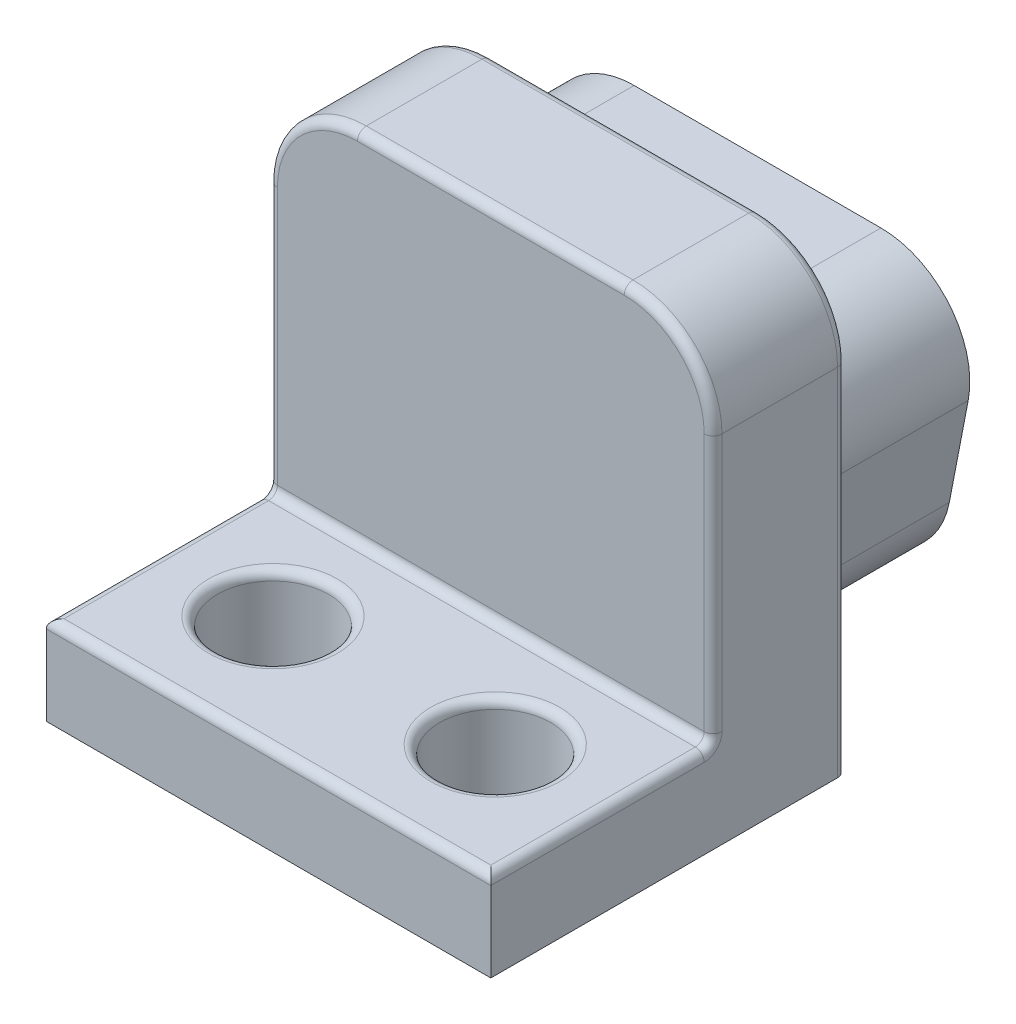
from build123d import *

# Parameters (mm, degrees)
SKETCH1_W           = 12.7
SKETCH1_H           = 10.16
BASE_EXTRUDE_DEPTH  = 12.7
BOSS_EXTRUDE1_DEPTH = 3.81
SKETCH4_R           = 0.635
CUT_EXTRUDE1_DEPTH  = 5.08
SKETCH5_R           = 0.635
CUT_EXTRUDE2_DEPTH  = 5.08
SKETCH6_R           = 0.3556
BOSS_EXTRUDE2_DEPTH = 0.254
LPATTERN1_COUNT     = 2
LPATTERN1_PITCH     = 2.7686
LPATTERN2_COUNT     = 4
LPATTERN2_PITCH     = 2.7686
LPATTERN3_COUNT     = 3
LPATTERN3_PITCH     = 2.7686
SKETCH7_R           = 0.3556
BOSS_EXTRUDE3_DEPTH = 0.254
LPATTERN4_COUNT     = 2
LPATTERN4_PITCH     = 2.7686
SKETCH9_W           = 6.35508
SKETCH9_H           = 10.16
CUT_EXTRUDE3_DEPTH  = 6.35
SKETCH11_R          = 1.5875
CUT_EXTRUDE4_DEPTH  = 19.680659624
FILLET1_R           = 2.54
FILLET2_R           = 0.254
FILETE1_R           = 0.254


with BuildPart() as part:
    # Sketch1 → Base-Extrude (new body)
    with BuildSketch(Plane(origin=(0, 0, 0), x_dir=(1, 0, 0), z_dir=(0, 1, 0))):
        with Locations((-3.81, 3.048)):
            Rectangle(SKETCH1_W, SKETCH1_H)
    extrude(amount=BASE_EXTRUDE_DEPTH)

    # Sketch2 → Boss-Extrude1 (add)
    with BuildSketch(Plane(origin=(0, 0, -8.128), x_dir=(-1, 0, 0), z_dir=(0, 0, -1))):
        with BuildLine():
            Line((0.825676487, 2.286), (6.794323513, 2.286))
            ThreePointArc((6.794323513, 2.286), (8.410817218, 2.8667787), (9.288078551, 4.34352118))
            Line((9.288078551, 4.34352118), (9.828647213, 7.13752118))
            ThreePointArc((9.828647213, 7.13752118), (9.294113475, 9.236493705), (7.334892175, 10.16))
            Line((7.334892175, 10.16), (0.285107825, 10.16))
            ThreePointArc((0.285107825, 10.16), (-1.674113475, 9.236493705), (-2.208647213, 7.13752118))
            Line((-2.208647213, 7.13752118), (-1.668078551, 4.34352118))
            ThreePointArc((-1.668078551, 4.34352118), (-0.790817218, 2.8667787), (0.825676487, 2.286))
        make_face()
    extrude(amount=BOSS_EXTRUDE1_DEPTH)

    # Sketch4 → Cut-Extrude1 (cut)
    with BuildSketch(Plane(origin=(0, 0, -11.938), x_dir=(-1, 0, 0), z_dir=(0, 0, -1))):
        with Locations((8.128, 7.62)):
            Circle(SKETCH4_R)
    cut_extrude1 = extrude(amount=-CUT_EXTRUDE1_DEPTH, mode=Mode.SUBTRACT)

    # Sketch5 → Cut-Extrude2 (cut)
    with BuildSketch(Plane(origin=(0, 0, -11.938), x_dir=(-1, 0, 0), z_dir=(0, 0, -1))):
        with Locations((6.858, 5.08)):
            Circle(SKETCH5_R)
    cut_extrude2 = extrude(amount=-CUT_EXTRUDE2_DEPTH, mode=Mode.SUBTRACT)

    # Sketch6 → Boss-Extrude2 (add)
    with BuildSketch(Plane.XZ):
        with Locations(Location((-5.08, 0, 0), (0, 0, 270))):
            Circle(SKETCH6_R)
    boss_extrude2 = extrude(amount=BOSS_EXTRUDE2_DEPTH)

    # LPattern1: Boss-Extrude2 ×2
    with Locations(*[(i * LPATTERN1_PITCH, 0, 0) for i in range(1, LPATTERN1_COUNT)]):
        add(boss_extrude2)

    # LPattern2: Cut-Extrude1 ×4
    with Locations(*[(i * LPATTERN2_PITCH, 0, 0) for i in range(1, LPATTERN2_COUNT)]):
        add(cut_extrude1, mode=Mode.SUBTRACT)

    # LPattern3: Cut-Extrude2 ×3
    with Locations(*[(i * LPATTERN3_PITCH, 0, 0) for i in range(1, LPATTERN3_COUNT)]):
        add(cut_extrude2, mode=Mode.SUBTRACT)

    # Sketch7 → Boss-Extrude3 (add)
    with BuildSketch(Plane.XZ):
        with Locations(Location((-5.08, -2.54, 0), (0, 0, 270))):
            Circle(SKETCH7_R)
    boss_extrude3 = extrude(amount=BOSS_EXTRUDE3_DEPTH)

    # LPattern4: Boss-Extrude3 ×2
    with Locations(*[(i * LPATTERN4_PITCH, 0, 0) for i in range(1, LPATTERN4_COUNT)]):
        add(boss_extrude3)

    # Sketch9 → Cut-Extrude3 (cut)
    with BuildSketch(Plane.XY.offset(2.032)):
        with Locations((-6.98246, 7.62)):
            Rectangle(SKETCH9_W, SKETCH9_H)
    cut_extrude3 = extrude(amount=-CUT_EXTRUDE3_DEPTH, mode=Mode.SUBTRACT)

    # Sketch11 → Cut-Extrude4 (cut, through all)
    with BuildSketch(Plane(origin=(0, 2.54, 0), x_dir=(-1, 0, 0), z_dir=(0, 1, 0))):
        with Locations(Location((6.985, -1.27, 0), (0, 0, 90))):
            Circle(SKETCH11_R)
    cut_extrude4 = extrude(amount=-CUT_EXTRUDE4_DEPTH, mode=Mode.SUBTRACT)

    # Mirror1: Cut-Extrude3, Cut-Extrude4 across plane
    add(cut_extrude3.mirror(Plane(origin=(-3.81, 0, 0), x_dir=(0, 0, 1), z_dir=(1, 0, 0))), mode=Mode.SUBTRACT)
    add(cut_extrude4.mirror(Plane(origin=(-3.81, 0, 0), x_dir=(0, 0, 1), z_dir=(1, 0, 0))), mode=Mode.SUBTRACT)

    # Fillet1
    fillet1_edges = [part.edges().sort_by_distance(p)[0] for p in [
        (-10.16, 12.7, -6.223),
        (2.54, 12.7, -6.223),
    ]]
    fillet(fillet1_edges, radius=FILLET1_R)

    # Fillet2
    fillet2_edges = [part.edges().sort_by_distance(p)[0] for p in [
        (2.54, 2.54, -1.143),
        (-0.635, 2.54, -2.8575),
        (-3.81, 12.7, -4.318),
        (-3.81, 12.7, -8.128),
        (-10.16, 6.35, -4.318),
        (2.54, 6.35, -4.318),
        (1.796051224, 11.956051224, -4.318),
        (-9.416051224, 11.956051224, -4.318),
        (-10.16, 5.08, -8.128),
        (2.54, 5.08, -8.128),
        (1.796051224, 11.956051224, -8.128),
        (-9.416051224, 11.956051224, -8.128),
        (-10.16, 2.54, -1.143),
        (-3.81, 2.54, -4.318),
        (-3.81, 2.54, 2.032),
        (-6.985, 2.54, -2.8575),
    ]]
    fillet(fillet2_edges, radius=FILLET2_R)

    # Filete1
    filete1_edges = [part.edges().sort_by_distance(p)[0] for p in [
        (-7.493, 7.62, -11.938),
        (-6.223, 5.08, -11.938),
        (-4.7244, 7.62, -11.938),
        (-1.9558, 7.62, -11.938),
        (0.8128, 7.62, -11.938),
        (-3.4544, 5.08, -11.938),
        (-0.6858, 5.08, -11.938),
    ]]
    fillet(filete1_edges, radius=FILETE1_R)


solid = part.part
